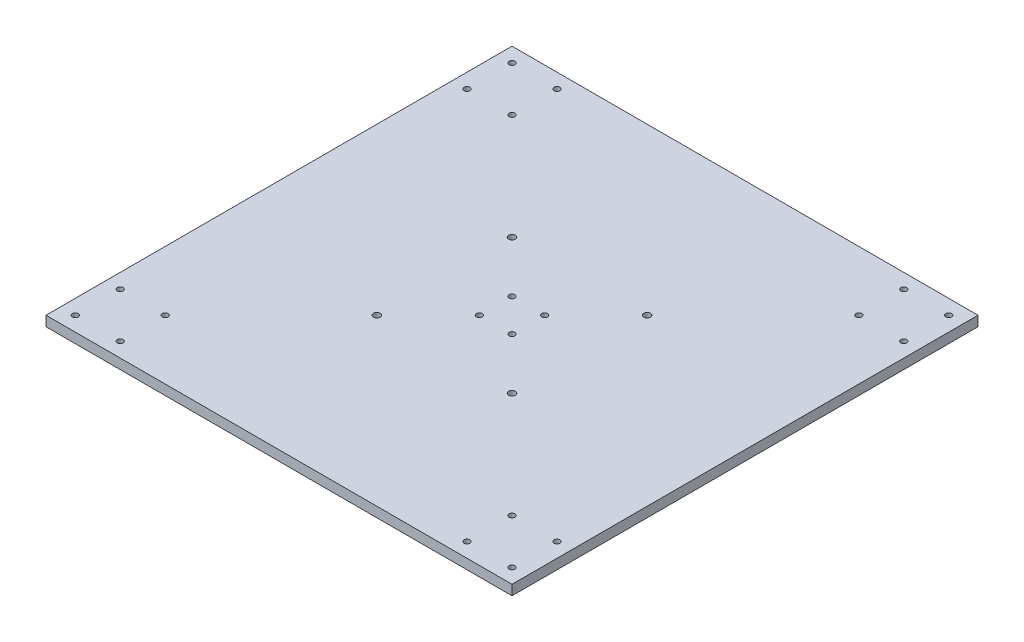
from build123d import *

# Parameters (mm, degrees)
SKETCH1_W           = 279.4
SKETCH1_H           = 279.4
SKETCH1_R           = 1.778
SKETCH1_R_2         = 2.032
BOSS_EXTRUDE1_DEPTH = 5.9944


with BuildPart() as part:
    # Sketch1 → Boss-Extrude1 (new body)
    with BuildSketch(Plane(origin=(0, 0, 0), x_dir=(1, 0, 0), z_dir=(0, 1, 0))):
        Rectangle(SKETCH1_W, SKETCH1_H)
        with Locations(Location((-130.9497, -130.9497, 0), (0, 0, 90))):
            Circle(SKETCH1_R, mode=Mode.SUBTRACT)
        with Locations(Location((-104.0003, -130.9497, 0), (0, 0, 90))):
            Circle(SKETCH1_R, mode=Mode.SUBTRACT)
        with Locations(Location((-130.9497, -104.0003, 0), (0, 0, 90))):
            Circle(SKETCH1_R, mode=Mode.SUBTRACT)
        with Locations(Location((-104.0003, -104.0003, 0), (0, 0, 90))):
            Circle(SKETCH1_R, mode=Mode.SUBTRACT)
        with Locations(Location((104.0003, -130.9497, 0), (0, 0, 90))):
            Circle(SKETCH1_R, mode=Mode.SUBTRACT)
        with Locations(Location((130.9497, -130.9497, 0), (0, 0, 90))):
            Circle(SKETCH1_R, mode=Mode.SUBTRACT)
        with Locations(Location((104.0003, -104.0003, 0), (0, 0, 90))):
            Circle(SKETCH1_R, mode=Mode.SUBTRACT)
        with Locations(Location((130.9497, -104.0003, 0), (0, 0, 90))):
            Circle(SKETCH1_R, mode=Mode.SUBTRACT)
        with Locations(Location((104.0003, 104.0003, 0), (0, 0, 90))):
            Circle(SKETCH1_R, mode=Mode.SUBTRACT)
        with Locations(Location((130.9497, 104.0003, 0), (0, 0, 90))):
            Circle(SKETCH1_R, mode=Mode.SUBTRACT)
        with Locations(Location((104.0003, 130.9497, 0), (0, 0, 90))):
            Circle(SKETCH1_R, mode=Mode.SUBTRACT)
        with Locations(Location((130.9497, 130.9497, 0), (0, 0, 90))):
            Circle(SKETCH1_R, mode=Mode.SUBTRACT)
        with Locations(Location((-130.9497, 104.0003, 0), (0, 0, 90))):
            Circle(SKETCH1_R, mode=Mode.SUBTRACT)
        with Locations(Location((-104.0003, 104.0003, 0), (0, 0, 90))):
            Circle(SKETCH1_R, mode=Mode.SUBTRACT)
        with Locations(Location((-130.9497, 130.9497, 0), (0, 0, 90))):
            Circle(SKETCH1_R, mode=Mode.SUBTRACT)
        with Locations(Location((-104.0003, 130.9497, 0), (0, 0, 90))):
            Circle(SKETCH1_R, mode=Mode.SUBTRACT)
        with Locations(Location((-9.779, -9.779, 0), (0, 0, 90))):
            Circle(SKETCH1_R, mode=Mode.SUBTRACT)
        with Locations(Location((-40.513, 40.513, 0), (0, 0, 90))):
            Circle(SKETCH1_R_2, mode=Mode.SUBTRACT)
        with Locations(Location((40.513, 40.513, 0), (0, 0, 90))):
            Circle(SKETCH1_R_2, mode=Mode.SUBTRACT)
        with Locations(Location((-40.513, -40.513, 0), (0, 0, 90))):
            Circle(SKETCH1_R_2, mode=Mode.SUBTRACT)
        with Locations(Location((40.513, -40.513, 0), (0, 0, 90))):
            Circle(SKETCH1_R_2, mode=Mode.SUBTRACT)
        with Locations(Location((9.779, -9.779, 0), (0, 0, 90))):
            Circle(SKETCH1_R, mode=Mode.SUBTRACT)
        with Locations(Location((-9.779, 9.779, 0), (0, 0, 90))):
            Circle(SKETCH1_R, mode=Mode.SUBTRACT)
        with Locations(Location((9.779, 9.779, 0), (0, 0, 90))):
            Circle(SKETCH1_R, mode=Mode.SUBTRACT)
    extrude(amount=BOSS_EXTRUDE1_DEPTH)


solid = part.part
